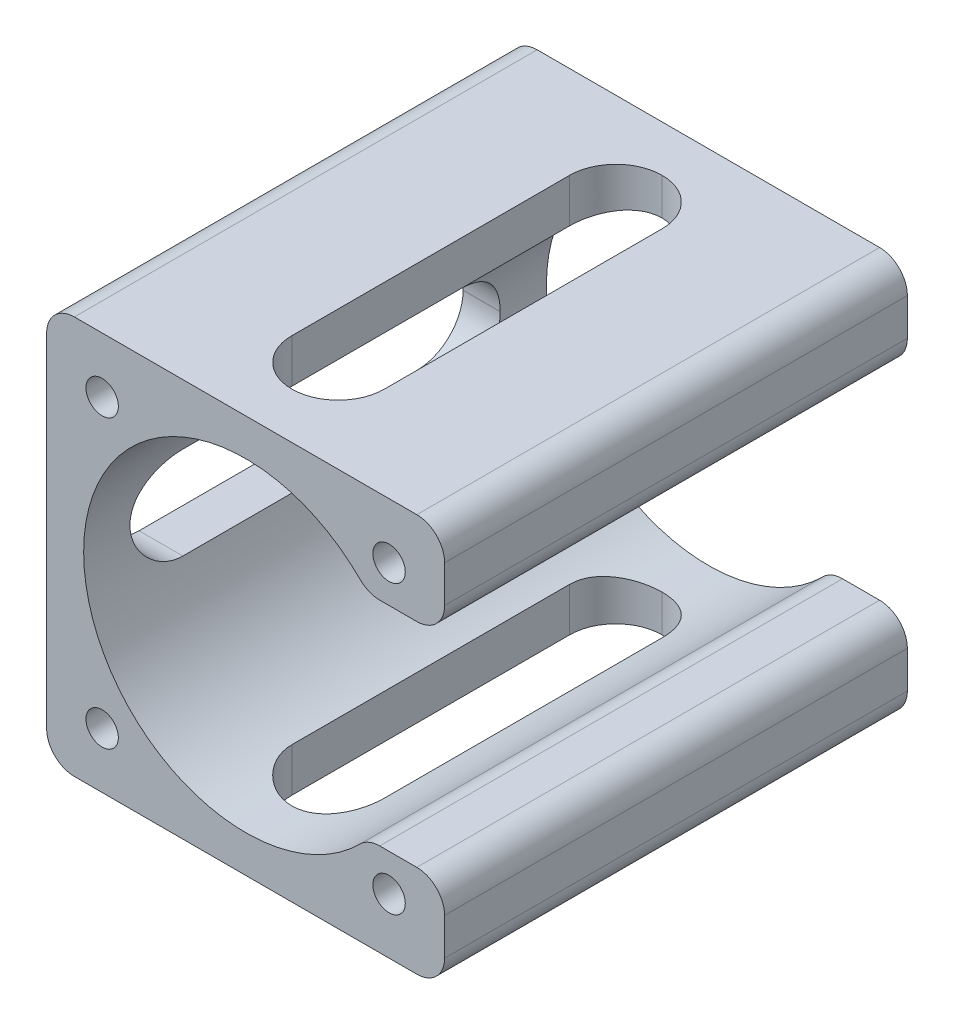
from build123d import *

# Parameters (mm, degrees)
SKETCH1_R           = 1.75
BOSS_EXTRUDE1_DEPTH = 50
CUT_EXTRUDE1_DEPTH  = 50
CUT_EXTRUDE2_DEPTH  = 50


with BuildPart() as part:
    # Sketch1 → Boss-Extrude1 (new body)
    with BuildSketch(Plane.XY):
        with BuildLine():
            Line((18.5, -21.5), (-18.5, -21.5))
            ThreePointArc((-18.5, -21.5), (-20.621320344, -20.621320344), (-21.5, -18.5))
            Line((-21.5, -18.5), (-21.5, 18.5))
            ThreePointArc((-21.5, 18.5), (-20.621320344, 20.621320344), (-18.5, 21.5))
            Line((-18.5, 21.5), (18.5, 21.5))
            ThreePointArc((18.5, 21.5), (20.621320344, 20.621320344), (21.5, 18.5))
            Line((21.5, 18.5), (21.5, 14.5))
            ThreePointArc((21.5, 14.5), (20.621320344, 12.378679656), (18.5, 11.5))
            Line((18.5, 11.5), (14.491376746, 11.5))
            ThreePointArc((14.491376746, 11.5), (13.343738663, 11.728190694), (12.370687466, 12.37804878))
            ThreePointArc((12.370687466, 12.37804878), (-17.5, 0), (12.370687466, -12.37804878))
            ThreePointArc((12.370687466, -12.37804878), (13.343738663, -11.728190694), (14.491376746, -11.5))
            Line((14.491376746, -11.5), (18.5, -11.5))
            ThreePointArc((18.5, -11.5), (20.621320344, -12.378679656), (21.5, -14.5))
            Line((21.5, -14.5), (21.5, -18.5))
            ThreePointArc((21.5, -18.5), (20.621320344, -20.621320344), (18.5, -21.5))
        make_face()
        with Locations((-15.5, 15.5)):
            Circle(SKETCH1_R, mode=Mode.SUBTRACT)
        with Locations((-15.5, -15.5)):
            Circle(SKETCH1_R, mode=Mode.SUBTRACT)
        with Locations((15.5, -15.5)):
            Circle(SKETCH1_R, mode=Mode.SUBTRACT)
        with Locations((15.5, 15.5)):
            Circle(SKETCH1_R, mode=Mode.SUBTRACT)
    extrude(amount=BOSS_EXTRUDE1_DEPTH)

    # Sketch2 → Cut-Extrude1 (cut)
    with BuildSketch(Plane(origin=(0, 21.5, 0), x_dir=(1, 0, 0), z_dir=(0, 1, 0))):
        with BuildLine():
            Line((-0.01, -45), (0.01, -45))
            ThreePointArc((0.01, -45), (3.538462838, -43.538462838), (5, -40.01))
            Line((5, -40.01), (5, -9.99))
            ThreePointArc((5, -9.99), (3.538462838, -6.461537162), (0.01, -5))
            Line((0.01, -5), (-0.01, -5))
            ThreePointArc((-0.01, -5), (-3.538462838, -6.461537162), (-5, -9.99))
            Line((-5, -9.99), (-5, -40.01))
            ThreePointArc((-5, -40.01), (-3.538462838, -43.538462838), (-0.01, -45))
        make_face()
    extrude(amount=-CUT_EXTRUDE1_DEPTH, mode=Mode.SUBTRACT)

    # Sketch3 → Cut-Extrude2 (cut)
    with BuildSketch(Plane.ZY.offset(21.5)):
        with BuildLine():
            Line((9.99, -5), (40.01, -5))
            ThreePointArc((40.01, -5), (43.538462838, -3.538462838), (45, -0.01))
            Line((45, -0.01), (45, 0.01))
            ThreePointArc((45, 0.01), (43.538462838, 3.538462838), (40.01, 5))
            Line((40.01, 5), (9.99, 5))
            ThreePointArc((9.99, 5), (6.461537162, 3.538462838), (5, 0.01))
            Line((5, 0.01), (5, -0.01))
            ThreePointArc((5, -0.01), (6.461537162, -3.538462838), (9.99, -5))
        make_face()
    extrude(amount=-CUT_EXTRUDE2_DEPTH, mode=Mode.SUBTRACT)


solid = part.part
